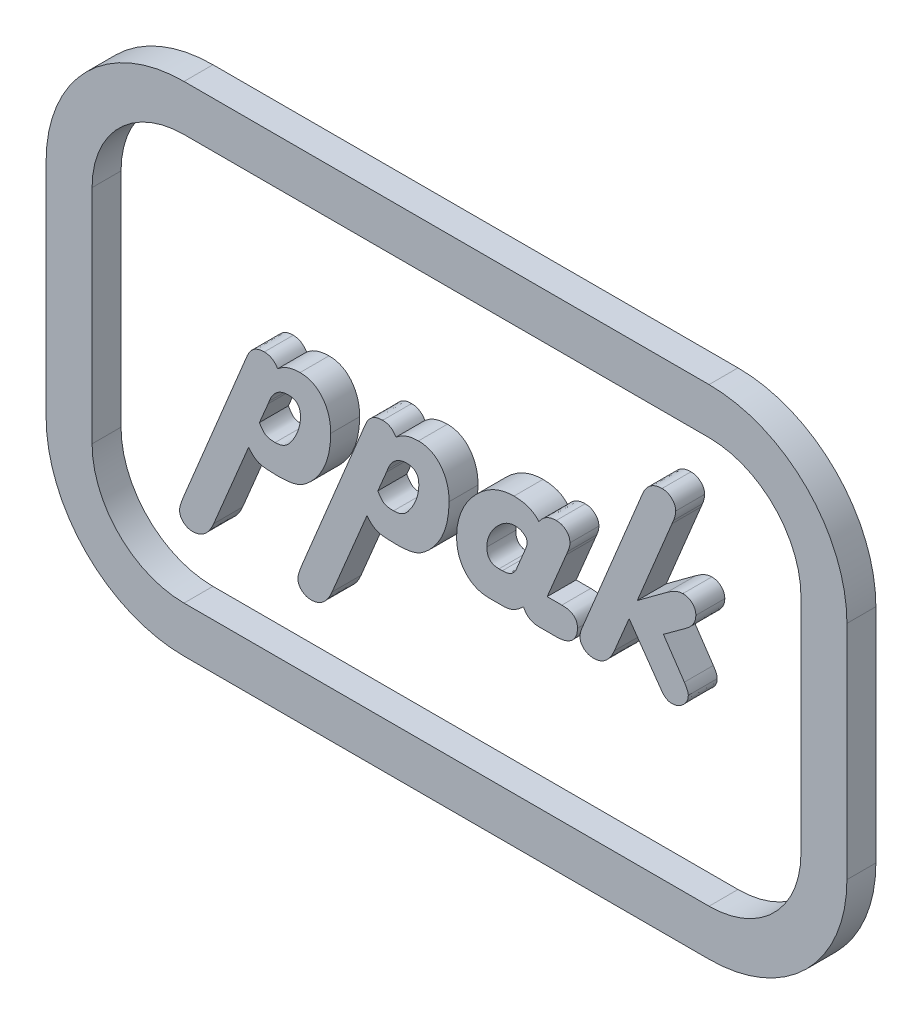
from build123d import *

# Parameters (mm, degrees)
BOSS_EXTRUDE1_DEPTH   = 1
BOSS_EXTRUDE1_2_DEPTH = 1
BOSS_EXTRUDE1_3_DEPTH = 1
BOSS_EXTRUDE1_4_DEPTH = 1
BOSS_EXTRUDE2_DEPTH   = 1


with BuildPart() as part:
    # Sketch1 → Boss-Extrude1 (new body)
    with BuildSketch(Plane.XY):
        with BuildLine():
            Line((-6.836579623, 0.35474101), (-8.042155394, -2.533476027))
            add(Edge.make_bspline(
                [(-8.042155394, -2.533476027), (-8.063354975, -2.580649846), (-8.103902871, -2.670878002), (-8.178148964, -2.792843804), (-8.257934921, -2.897269548), (-8.34564895, -2.983385989), (-8.4417999, -3.049720443), (-8.545520345, -3.096204742), (-8.656154842, -3.126513296), (-8.732860748, -3.129819027), (-8.772024829, -3.131506849)],
                knots=[0, 0, 0, 0, 1.233595779, 2.359467117, 3.400032463, 4.363738274, 5.281692613, 6.172289348, 7.066817518, 8, 8, 8, 8], degree=3))
            add(Edge.make_bspline(
                [(-8.772024829, -3.131506849), (-8.80205238, -3.129824185), (-8.8602156, -3.126564872), (-8.944636897, -3.104373054), (-9.020989743, -3.065272903), (-9.090162031, -3.014420965), (-9.14709228, -2.951845091), (-9.190403496, -2.882231014), (-9.216000728, -2.805206849), (-9.219019892, -2.752030985), (-9.220547945, -2.725117723)],
                knots=[0, 0, 0, 0, 1.073828919, 2.080001417, 3.094489531, 4.12502559, 5.134324473, 6.101378834, 7.039073625, 8, 8, 8, 8], degree=3))
            add(Edge.make_bspline(
                [(-9.220547945, -2.725117723), (-9.219044867, -2.698281433), (-9.215694263, -2.638459002), (-9.191039984, -2.540866381), (-9.154271042, -2.425805164), (-9.122292146, -2.343926031), (-9.105019264, -2.299700342)],
                knots=[0, 0, 0, 0, 0.726678964, 1.619884938, 2.714419364, 4, 4, 4, 4], degree=3))
            Line((-9.105019264, -2.299700342), (-6.882791096, 3.073062928))
            add(Edge.make_bspline(
                [(-6.882791096, 3.073062928), (-6.868207366, 3.105200238), (-6.839953517, 3.167461588), (-6.785387867, 3.251143937), (-6.722056789, 3.321183547), (-6.651896563, 3.379469475), (-6.573576701, 3.425173332), (-6.486396415, 3.456111761), (-6.3920803, 3.475533849), (-6.326538863, 3.47812352), (-6.29291524, 3.479452055)],
                knots=[0, 0, 0, 0, 1.105756702, 2.14224231, 3.118129428, 4.056898495, 4.992759649, 5.94572338, 6.946128963, 8, 8, 8, 8], degree=3))
            add(Edge.make_bspline(
                [(-6.29291524, 3.479452055), (-6.24667753, 3.47600602), (-6.15583615, 3.469235734), (-6.027468234, 3.416457942), (-5.916197854, 3.327050273), (-5.861052874, 3.247789412), (-5.832159675, 3.206260702)],
                knots=[0, 0, 0, 0, 0.987895729, 1.940879239, 2.92112416, 4, 4, 4, 4], degree=3))
            add(Edge.make_bspline(
                [(-5.832159675, 3.206260702), (-5.777893093, 3.2484315), (-5.669846102, 3.33239529), (-5.480917603, 3.417648736), (-5.275440092, 3.469638945), (-5.132518298, 3.476112763), (-5.058797089, 3.479452055)],
                knots=[0, 0, 0, 0, 0.981752114, 1.954708766, 2.94500805, 4, 4, 4, 4], degree=3))
            add(Edge.make_bspline(
                [(-5.058797089, 3.479452055), (-5.020237905, 3.478413189), (-4.944574103, 3.476374645), (-4.833591715, 3.460158319), (-4.729110949, 3.431107342), (-4.629270588, 3.393015672), (-4.535881008, 3.342519444), (-4.447569196, 3.281230994), (-4.367991798, 3.206140721), (-4.291270542, 3.124346089), (-4.224143098, 3.031440065), (-4.16380317, 2.9322573), (-4.113396357, 2.825619981), (-4.072700812, 2.711669361), (-4.039968926, 2.590849557), (-4.017189441, 2.462602607), (-4.003273974, 2.327648609), (-4.002013934, 2.235401396), (-4.001369863, 2.188249144)],
                knots=[0, 0, 0, 0, 0.987428927, 1.937609098, 2.863748343, 3.760187832, 4.668712679, 5.576570338, 6.504670283, 7.465560223, 8.444979229, 9.434043199, 10.435822681, 11.459934607, 12.529578907, 13.63804652, 14.7926852, 16, 16, 16, 16], degree=3))
            add(Edge.make_bspline(
                [(-4.001369863, 2.188249144), (-4.003363625, 2.098892348), (-4.007273926, 1.923639792), (-4.040781913, 1.667051267), (-4.094457216, 1.422910774), (-4.171399308, 1.191274087), (-4.268769027, 0.972385111), (-4.388744026, 0.766175395), (-4.52942136, 0.57197219), (-4.640159822, 0.455501609), (-4.695901113, 0.396875)],
                knots=[0, 0, 0, 0, 1.086059278, 2.130052466, 3.140384095, 4.121089527, 5.092593551, 6.047781849, 7.017331842, 8, 8, 8, 8], degree=3))
            add(Edge.make_bspline(
                [(-4.695901113, 0.396875), (-4.733781748, 0.361272887), (-4.806804727, 0.292642244), (-4.923345247, 0.20434602), (-5.041960188, 0.134591116), (-5.165768617, 0.080380468), (-5.303186718, 0.043441195), (-5.460372789, 0.019021243), (-5.64108051, 0.002532199), (-5.76959664, 0.000876208), (-5.837596318, 0)],
                knots=[0, 0, 0, 0, 0.998797502, 1.925394575, 2.803626065, 3.638381051, 4.515229771, 5.530295894, 6.693245065, 8, 8, 8, 8], degree=3))
            add(Edge.make_bspline(
                [(-5.837596318, 0), (-5.908753945, 0.0005699), (-6.039414228, 0.001616354), (-6.217238161, 0.013932514), (-6.360031288, 0.030600451), (-6.473829741, 0.059222429), (-6.569393471, 0.1050888), (-6.658271997, 0.170100399), (-6.749731089, 0.253252719), (-6.806512568, 0.319605655), (-6.836579623, 0.35474101)],
                knots=[0, 0, 0, 0, 1.53519449, 2.818938113, 3.84486776, 4.63459067, 5.338636183, 6.117144677, 7.002986248, 8, 8, 8, 8], degree=3))
        make_face()
        with BuildLine():
            add(Edge.make_bspline(
                [(-6.461451199, 1.283047945), (-6.443645173, 1.251288263), (-6.410620271, 1.192383462), (-6.353683515, 1.117665072), (-6.302012797, 1.057748815), (-6.246881081, 1.01381881), (-6.182523716, 0.988295382), (-6.107771482, 0.968916973), (-6.01814427, 0.959309901), (-5.953590988, 0.95770544), (-5.919145976, 0.956849315)],
                knots=[0, 0, 0, 0, 1.281705762, 2.377184463, 3.304212624, 4.067557999, 4.832905158, 5.723741181, 6.78541012, 8, 8, 8, 8], degree=3))
            add(Edge.make_bspline(
                [(-5.919145976, 0.956849315), (-5.867515726, 0.959320235), (-5.768429414, 0.964062305), (-5.629846186, 1.011843893), (-5.506674027, 1.085172284), (-5.44487923, 1.156942733), (-5.413538099, 1.193343322)],
                knots=[0, 0, 0, 0, 1.066885074, 2.04751495, 3.009737206, 4, 4, 4, 4], degree=3))
            add(Edge.make_bspline(
                [(-5.413538099, 1.193343322), (-5.383908381, 1.232768254), (-5.325789519, 1.310100485), (-5.250936173, 1.43160239), (-5.188457816, 1.554176252), (-5.136643418, 1.676791926), (-5.094600918, 1.800034694), (-5.067059083, 1.925009163), (-5.047978429, 2.050388542), (-5.046127037, 2.134265632), (-5.045205479, 2.176016695)],
                knots=[0, 0, 0, 0, 1.106882035, 2.17115544, 3.199327812, 4.193108843, 5.158152015, 6.118088392, 7.063250621, 8, 8, 8, 8], degree=3))
            add(Edge.make_bspline(
                [(-5.045205479, 2.176016695), (-5.046493845, 2.210078562), (-5.048921871, 2.274270799), (-5.067113657, 2.363990339), (-5.100382564, 2.440167957), (-5.147318026, 2.50266881), (-5.20778279, 2.552030311), (-5.282104725, 2.585973252), (-5.3689745, 2.606248309), (-5.431088782, 2.608435991), (-5.463827055, 2.609589041)],
                knots=[0, 0, 0, 0, 1.183423394, 2.230253451, 3.160617766, 4.048586677, 4.921493439, 5.844099008, 6.863699742, 8, 8, 8, 8], degree=3))
            add(Edge.make_bspline(
                [(-5.463827055, 2.609589041), (-5.501126902, 2.608159726), (-5.573417696, 2.605389572), (-5.677769508, 2.579827933), (-5.773549635, 2.538673831), (-5.862587522, 2.482251312), (-5.941338814, 2.407808073), (-6.011582714, 2.317168527), (-6.073991109, 2.211093551), (-6.107170428, 2.132508038), (-6.124379281, 2.091748716)],
                knots=[0, 0, 0, 0, 0.994323491, 1.927097285, 2.848115774, 3.767306292, 4.725678418, 5.724844064, 6.819962974, 8, 8, 8, 8], degree=3))
            add(Edge.make_bspline(
                [(-6.124379281, 2.091748716), (-6.131215988, 2.074095158), (-6.143644428, 2.042002786), (-6.155667345, 2.009756397), (-6.161076627, 1.995248288)],
                knots=[0, 0, 0, 0, 1.10017156, 2, 2, 2, 2], degree=3))
            Line((-6.161076627, 1.995248288), (-6.461451199, 1.283047945))
        make_face(mode=Mode.SUBTRACT)
    extrude(amount=BOSS_EXTRUDE1_DEPTH)


with BuildPart() as body_2:
    # Sketch1 → Boss-Extrude1 2 (new body)
    with BuildSketch(Plane.XY):
        with BuildLine():
            Line((-2.748223459, 0.35474101), (-3.953799229, -2.533476027))
            add(Edge.make_bspline(
                [(-3.953799229, -2.533476027), (-3.97499881, -2.580649846), (-4.015546707, -2.670878002), (-4.0897928, -2.792843804), (-4.169578757, -2.897269548), (-4.257292786, -2.983385989), (-4.353443735, -3.049720443), (-4.457164181, -3.096204742), (-4.567798678, -3.126513296), (-4.644504584, -3.129819027), (-4.683668664, -3.131506849)],
                knots=[0, 0, 0, 0, 1.233595779, 2.359467117, 3.400032463, 4.363738274, 5.281692613, 6.172289348, 7.066817518, 8, 8, 8, 8], degree=3))
            add(Edge.make_bspline(
                [(-4.683668664, -3.131506849), (-4.713696215, -3.129824185), (-4.771859436, -3.126564872), (-4.856280732, -3.104373054), (-4.932633579, -3.065272903), (-5.001805867, -3.014420965), (-5.058736116, -2.951845091), (-5.102047331, -2.882231014), (-5.127644563, -2.805206849), (-5.130663727, -2.752030985), (-5.132191781, -2.725117723)],
                knots=[0, 0, 0, 0, 1.073828919, 2.080001417, 3.094489531, 4.12502559, 5.134324473, 6.101378834, 7.039073625, 8, 8, 8, 8], degree=3))
            add(Edge.make_bspline(
                [(-5.132191781, -2.725117723), (-5.130688703, -2.698281433), (-5.127338098, -2.638459002), (-5.10268382, -2.540866381), (-5.065914877, -2.425805164), (-5.033935982, -2.343926031), (-5.016663099, -2.299700342)],
                knots=[0, 0, 0, 0, 0.726678964, 1.619884938, 2.714419364, 4, 4, 4, 4], degree=3))
            Line((-5.016663099, -2.299700342), (-2.794434932, 3.073062928))
            add(Edge.make_bspline(
                [(-2.794434932, 3.073062928), (-2.779851202, 3.105200238), (-2.751597352, 3.167461588), (-2.697031703, 3.251143937), (-2.633700625, 3.321183547), (-2.563540398, 3.379469475), (-2.485220537, 3.425173332), (-2.39804025, 3.456111761), (-2.303724135, 3.475533849), (-2.238182698, 3.47812352), (-2.204559075, 3.479452055)],
                knots=[0, 0, 0, 0, 1.105756702, 2.14224231, 3.118129428, 4.056898495, 4.992759649, 5.94572338, 6.946128963, 8, 8, 8, 8], degree=3))
            add(Edge.make_bspline(
                [(-2.204559075, 3.479452055), (-2.158321365, 3.47600602), (-2.067479985, 3.469235734), (-1.939112069, 3.416457942), (-1.827841689, 3.327050273), (-1.772696709, 3.247789412), (-1.74380351, 3.206260702)],
                knots=[0, 0, 0, 0, 0.987895729, 1.940879239, 2.92112416, 4, 4, 4, 4], degree=3))
            add(Edge.make_bspline(
                [(-1.74380351, 3.206260702), (-1.689536929, 3.2484315), (-1.581489938, 3.33239529), (-1.392561438, 3.417648736), (-1.187083928, 3.469638945), (-1.044162134, 3.476112763), (-0.970440925, 3.479452055)],
                knots=[0, 0, 0, 0, 0.981752114, 1.954708766, 2.94500805, 4, 4, 4, 4], degree=3))
            add(Edge.make_bspline(
                [(-0.970440925, 3.479452055), (-0.93188174, 3.478413189), (-0.856217938, 3.476374645), (-0.745235551, 3.460158319), (-0.640754785, 3.431107342), (-0.540914423, 3.393015672), (-0.447524844, 3.342519444), (-0.359213032, 3.281230994), (-0.279635634, 3.206140721), (-0.202914378, 3.124346089), (-0.135786933, 3.031440065), (-0.075447005, 2.9322573), (-0.025040193, 2.825619981), (0.015655353, 2.711669361), (0.048387239, 2.590849557), (0.071166724, 2.462602607), (0.08508219, 2.327648609), (0.086342231, 2.235401396), (0.086986301, 2.188249144)],
                knots=[0, 0, 0, 0, 0.987428927, 1.937609098, 2.863748343, 3.760187832, 4.668712679, 5.576570338, 6.504670283, 7.465560223, 8.444979229, 9.434043199, 10.435822681, 11.459934607, 12.529578907, 13.63804652, 14.7926852, 16, 16, 16, 16], degree=3))
            add(Edge.make_bspline(
                [(0.086986301, 2.188249144), (0.084992539, 2.098892348), (0.081082238, 1.923639792), (0.047574251, 1.667051267), (-0.006101051, 1.422910774), (-0.083043144, 1.191274087), (-0.180412863, 0.972385111), (-0.300387861, 0.766175395), (-0.441065195, 0.57197219), (-0.551803657, 0.455501609), (-0.607544949, 0.396875)],
                knots=[0, 0, 0, 0, 1.086059278, 2.130052466, 3.140384095, 4.121089527, 5.092593551, 6.047781849, 7.017331842, 8, 8, 8, 8], degree=3))
            add(Edge.make_bspline(
                [(-0.607544949, 0.396875), (-0.645425584, 0.361272887), (-0.718448563, 0.292642244), (-0.834989082, 0.20434602), (-0.953604024, 0.134591116), (-1.077412452, 0.080380468), (-1.214830554, 0.043441195), (-1.372016625, 0.019021243), (-1.552724346, 0.002532199), (-1.681240475, 0.000876208), (-1.749240154, 0)],
                knots=[0, 0, 0, 0, 0.998797502, 1.925394575, 2.803626065, 3.638381051, 4.515229771, 5.530295894, 6.693245065, 8, 8, 8, 8], degree=3))
            add(Edge.make_bspline(
                [(-1.749240154, 0), (-1.820397781, 0.0005699), (-1.951058063, 0.001616354), (-2.128881997, 0.013932514), (-2.271675124, 0.030600451), (-2.385473577, 0.059222429), (-2.481037306, 0.1050888), (-2.569915833, 0.170100399), (-2.661374925, 0.253252719), (-2.718156404, 0.319605655), (-2.748223459, 0.35474101)],
                knots=[0, 0, 0, 0, 1.53519449, 2.818938113, 3.84486776, 4.63459067, 5.338636183, 6.117144677, 7.002986248, 8, 8, 8, 8], degree=3))
        make_face()
        with BuildLine():
            add(Edge.make_bspline(
                [(-2.373095034, 1.283047945), (-2.355289009, 1.251288263), (-2.322264107, 1.192383462), (-2.265327351, 1.117665072), (-2.213656632, 1.057748815), (-2.158524917, 1.01381881), (-2.094167552, 0.988295382), (-2.019415318, 0.968916973), (-1.929788105, 0.959309901), (-1.865234824, 0.95770544), (-1.830789812, 0.956849315)],
                knots=[0, 0, 0, 0, 1.281705762, 2.377184463, 3.304212624, 4.067557999, 4.832905158, 5.723741181, 6.78541012, 8, 8, 8, 8], degree=3))
            add(Edge.make_bspline(
                [(-1.830789812, 0.956849315), (-1.779159562, 0.959320235), (-1.680073249, 0.964062305), (-1.541490021, 1.011843893), (-1.418317863, 1.085172284), (-1.356523065, 1.156942733), (-1.325181935, 1.193343322)],
                knots=[0, 0, 0, 0, 1.066885074, 2.04751495, 3.009737206, 4, 4, 4, 4], degree=3))
            add(Edge.make_bspline(
                [(-1.325181935, 1.193343322), (-1.295552217, 1.232768254), (-1.237433355, 1.310100485), (-1.162580009, 1.43160239), (-1.100101651, 1.554176252), (-1.048287253, 1.676791926), (-1.006244753, 1.800034694), (-0.978702919, 1.925009163), (-0.959622265, 2.050388542), (-0.957770873, 2.134265632), (-0.956849315, 2.176016695)],
                knots=[0, 0, 0, 0, 1.106882035, 2.17115544, 3.199327812, 4.193108843, 5.158152015, 6.118088392, 7.063250621, 8, 8, 8, 8], degree=3))
            add(Edge.make_bspline(
                [(-0.956849315, 2.176016695), (-0.958137681, 2.210078562), (-0.960565707, 2.274270799), (-0.978757492, 2.363990339), (-1.0120264, 2.440167957), (-1.058961862, 2.50266881), (-1.119426625, 2.552030311), (-1.193748561, 2.585973252), (-1.280618335, 2.606248309), (-1.342732618, 2.608435991), (-1.37547089, 2.609589041)],
                knots=[0, 0, 0, 0, 1.183423394, 2.230253451, 3.160617766, 4.048586677, 4.921493439, 5.844099008, 6.863699742, 8, 8, 8, 8], degree=3))
            add(Edge.make_bspline(
                [(-1.37547089, 2.609589041), (-1.412770738, 2.608159726), (-1.485061532, 2.605389572), (-1.589413343, 2.579827933), (-1.68519347, 2.538673831), (-1.774231357, 2.482251312), (-1.852982649, 2.407808073), (-1.923226549, 2.317168527), (-1.985634945, 2.211093551), (-2.018814263, 2.132508038), (-2.036023116, 2.091748716)],
                knots=[0, 0, 0, 0, 0.994323491, 1.927097285, 2.848115774, 3.767306292, 4.725678418, 5.724844064, 6.819962974, 8, 8, 8, 8], degree=3))
            add(Edge.make_bspline(
                [(-2.036023116, 2.091748716), (-2.042859824, 2.074095158), (-2.055288263, 2.042002786), (-2.067311181, 2.009756397), (-2.072720462, 1.995248288)],
                knots=[0, 0, 0, 0, 1.10017156, 2, 2, 2, 2], degree=3))
            Line((-2.072720462, 1.995248288), (-2.373095034, 1.283047945))
        make_face(mode=Mode.SUBTRACT)
    extrude(amount=BOSS_EXTRUDE1_2_DEPTH)


with BuildPart() as body_3:
    # Sketch1 → Boss-Extrude1 3 (new body)
    with BuildSketch(Plane.XY):
        with BuildLine():
            Line((3.476733733, 1.043835616), (3.98234161, 1.043835616))
            add(Edge.make_bspline(
                [(3.98234161, 1.043835616), (4.02452349, 1.042506373), (4.103935384, 1.04000393), (4.215864046, 1.022335916), (4.310084339, 0.987880476), (4.39007905, 0.943620611), (4.449857437, 0.88135944), (4.493210246, 0.8069304), (4.519708089, 0.718916333), (4.522052642, 0.655762814), (4.523287671, 0.622495719)],
                knots=[0, 0, 0, 0, 1.294214641, 2.436497235, 3.45633191, 4.35958604, 5.214514041, 6.067746316, 6.982155433, 8, 8, 8, 8], degree=3))
            add(Edge.make_bspline(
                [(4.523287671, 0.622495719), (4.521148494, 0.576037578), (4.517046327, 0.486947666), (4.4798077, 0.360748831), (4.41498892, 0.25235422), (4.328365393, 0.159655609), (4.219008486, 0.087712502), (4.090939917, 0.034996233), (3.94372034, 0.006320504), (3.83974765, 0.002173262), (3.785263271, 0)],
                knots=[0, 0, 0, 0, 1.02006706, 1.956119682, 2.85821293, 3.77438774, 4.72208319, 5.713685443, 6.801912016, 8, 8, 8, 8], degree=3))
            Line((3.785263271, 0), (3.198105736, 0))
            add(Edge.make_bspline(
                [(3.198105736, 0), (3.166331732, 0.001056591), (3.105575772, 0.003076928), (3.018122978, 0.018078334), (2.938386755, 0.044012893), (2.866110894, 0.080384811), (2.802487433, 0.127984205), (2.745863751, 0.184113634), (2.697554475, 0.251670225), (2.673583397, 0.302656571), (2.661237158, 0.328916952)],
                knots=[0, 0, 0, 0, 1.135602606, 2.17141737, 3.159933094, 4.123316935, 5.049777826, 5.988893951, 6.964185235, 8, 8, 8, 8], degree=3))
            add(Edge.make_bspline(
                [(2.661237158, 0.328916952), (2.606185845, 0.278774613), (2.502457221, 0.184295561), (2.331358648, 0.082236738), (2.164050292, 0.012255813), (2.05022531, 0.003991588), (1.995248288, 0)],
                knots=[0, 0, 0, 0, 1.172355213, 2.208971714, 3.134940325, 4, 4, 4, 4], degree=3))
            Line((1.995248288, 0), (1.473330479, 0))
            add(Edge.make_bspline(
                [(1.473330479, 0), (1.432039433, 0.00096817), (1.351386036, 0.002859288), (1.233537506, 0.019891535), (1.121447253, 0.046124124), (1.016402742, 0.086803587), (0.916497804, 0.13518507), (0.822874128, 0.195828693), (0.73648765, 0.268137451), (0.655721614, 0.349589556), (0.584457231, 0.441069616), (0.519771972, 0.538506666), (0.466950168, 0.644236936), (0.423207876, 0.75614656), (0.389634794, 0.8745476), (0.364472302, 0.99942422), (0.351691056, 1.13146277), (0.349212714, 1.221863277), (0.347945205, 1.268097175)],
                knots=[0, 0, 0, 0, 1.038881097, 2.029236264, 2.991883691, 3.930308829, 4.858629969, 5.782385855, 6.730121337, 7.689859128, 8.664191716, 9.644845373, 10.629272188, 11.633194497, 12.665607055, 13.723595041, 14.835769002, 16, 16, 16, 16], degree=3))
            add(Edge.make_bspline(
                [(0.347945205, 1.268097175), (0.349707489, 1.338875297), (0.353190259, 1.478752839), (0.383036056, 1.685781851), (0.430122427, 1.887049331), (0.497276053, 2.082766533), (0.58380406, 2.271963482), (0.686713442, 2.456807824), (0.812386049, 2.63378654), (0.952747033, 2.80416919), (1.105517153, 2.960979196), (1.264781916, 3.099956106), (1.430823783, 3.21576747), (1.600002435, 3.313624146), (1.776135106, 3.387271379), (1.956416913, 3.440977111), (2.14226877, 3.472871929), (2.267867419, 3.477251837), (2.330961045, 3.479452055)],
                knots=[0, 0, 0, 0, 1.038393463, 2.052158511, 3.063456151, 4.068635755, 5.08344709, 6.113632118, 7.168837633, 8.264602753, 9.350863708, 10.378663772, 11.361961956, 12.31789787, 13.241700555, 14.156967694, 15.07416527, 16, 16, 16, 16], degree=3))
            add(Edge.make_bspline(
                [(2.330961045, 3.479452055), (2.378101024, 3.478286595), (2.469457213, 3.47602796), (2.602204123, 3.462118841), (2.724455952, 3.433596581), (2.838578369, 3.400104216), (2.941044884, 3.351249541), (3.0345284, 3.294105411), (3.118787207, 3.226336786), (3.165353533, 3.17214292), (3.18859161, 3.145098459)],
                knots=[0, 0, 0, 0, 1.187749171, 2.30183041, 3.353985773, 4.346587157, 5.291117026, 6.203238886, 7.103359092, 8, 8, 8, 8], degree=3))
            add(Edge.make_bspline(
                [(3.18859161, 3.145098459), (3.207957149, 3.171828114), (3.245576603, 3.223753082), (3.309979116, 3.292164519), (3.378859081, 3.350018693), (3.451772274, 3.398395088), (3.530971633, 3.432953477), (3.612298443, 3.461570417), (3.699584108, 3.476036297), (3.758943906, 3.478295279), (3.789340753, 3.479452055)],
                knots=[0, 0, 0, 0, 1.102961423, 2.142610407, 3.131917189, 4.106850711, 5.056016811, 6.014208465, 6.983119812, 8, 8, 8, 8], degree=3))
            add(Edge.make_bspline(
                [(3.789340753, 3.479452055), (3.8216237, 3.477797113), (3.884785592, 3.474559205), (3.975373463, 3.45192323), (4.056415958, 3.410611416), (4.127599514, 3.356704688), (4.188294698, 3.292277197), (4.230701554, 3.217028567), (4.258476681, 3.134780762), (4.261022781, 3.076918503), (4.262328767, 3.04723887)],
                knots=[0, 0, 0, 0, 1.085152088, 2.123110344, 3.11068521, 4.121931818, 5.11360817, 6.061884541, 7.005870879, 8, 8, 8, 8], degree=3))
            add(Edge.make_bspline(
                [(4.262328767, 3.04723887), (4.261533328, 3.025432396), (4.259845836, 2.97917082), (4.245126076, 2.907219732), (4.222034053, 2.829397744), (4.200318831, 2.777035076), (4.188934075, 2.74958262)],
                knots=[0, 0, 0, 0, 0.847236183, 1.797378234, 2.845219729, 4, 4, 4, 4], degree=3))
            Line((4.188934075, 2.74958262), (4.13864512, 2.628617295))
            Line((4.13864512, 2.628617295), (3.476733733, 1.043835616))
        make_face()
        with BuildLine():
            Line((1.811761558, 1.043835616), (1.92729024, 1.043835616))
            add(Edge.make_bspline(
                [(1.92729024, 1.043835616), (1.95633743, 1.044472463), (2.012514616, 1.045704124), (2.093084288, 1.059234861), (2.165713064, 1.082461862), (2.231147384, 1.113936195), (2.288426565, 1.155023391), (2.338478324, 1.204703672), (2.379820578, 1.264388078), (2.400487179, 1.308971724), (2.411151541, 1.33197774)],
                knots=[0, 0, 0, 0, 1.157664044, 2.238919033, 3.244614913, 4.190073881, 5.122668863, 6.042574887, 6.989931157, 8, 8, 8, 8], degree=3))
            Line((2.411151541, 1.33197774), (2.72104024, 2.076797945))
            add(Edge.make_bspline(
                [(2.72104024, 2.076797945), (2.739555334, 2.121007071), (2.772483951, 2.199631862), (2.780188991, 2.284359787), (2.783561644, 2.321446918)],
                knots=[0, 0, 0, 0, 1.124559448, 2, 2, 2, 2], degree=3))
            add(Edge.make_bspline(
                [(2.783561644, 2.321446918), (2.781714326, 2.34017492), (2.777987692, 2.377955337), (2.755818532, 2.433399187), (2.713357203, 2.480667534), (2.661130729, 2.525169888), (2.597874374, 2.562857909), (2.526557199, 2.589837367), (2.449089621, 2.606795264), (2.395385688, 2.608637761), (2.36765839, 2.609589041)],
                knots=[0, 0, 0, 0, 0.81058345, 1.635208074, 2.524363624, 3.523748651, 4.593951107, 5.683817953, 6.804157088, 8, 8, 8, 8], degree=3))
            add(Edge.make_bspline(
                [(2.36765839, 2.609589041), (2.339473265, 2.608637096), (2.282549852, 2.606714522), (2.198134465, 2.587864309), (2.114628297, 2.559291529), (2.031763706, 2.518827139), (1.949492875, 2.467179201), (1.867219767, 2.404311584), (1.787446216, 2.328516929), (1.682766067, 2.217333621), (1.569704266, 2.067474441), (1.468308311, 1.878036794), (1.404012666, 1.684006721), (1.395830251, 1.552168192), (1.391780822, 1.486922089)],
                knots=[0, 0, 0, 0, 0.627706518, 1.267732443, 1.919531944, 2.592823818, 3.31892668, 4.082778462, 4.897707917, 5.769757387, 7.487317347, 9.064628885, 10.547302323, 12, 12, 12, 12], degree=3))
            add(Edge.make_bspline(
                [(1.391780822, 1.486922089), (1.393084859, 1.45240254), (1.395560805, 1.386861086), (1.413855302, 1.295050921), (1.446191925, 1.216535168), (1.494374844, 1.152977017), (1.555442335, 1.103269153), (1.629647695, 1.067069572), (1.71696756, 1.047301982), (1.779043496, 1.045032029), (1.811761558, 1.043835616)],
                knots=[0, 0, 0, 0, 1.183693291, 2.247450585, 3.194323595, 4.070859252, 4.954393584, 5.871857821, 6.878330445, 8, 8, 8, 8], degree=3))
        make_face(mode=Mode.SUBTRACT)
    extrude(amount=BOSS_EXTRUDE1_3_DEPTH)


with BuildPart() as body_4:
    # Sketch1 → Boss-Extrude1 4 (new body)
    with BuildSketch(Plane.XY):
        with BuildLine():
            Line((7.491695205, 1.924571918), (8.214768836, 0.854912243))
            add(Edge.make_bspline(
                [(8.214768836, 0.854912243), (8.235462933, 0.823624583), (8.273730963, 0.765766682), (8.316180386, 0.679083107), (8.345055967, 0.601658518), (8.348922082, 0.551558112), (8.350684932, 0.528713613)],
                knots=[0, 0, 0, 0, 1.255887376, 2.322417502, 3.235065423, 4, 4, 4, 4], degree=3))
            add(Edge.make_bspline(
                [(8.350684932, 0.528713613), (8.348745233, 0.495330382), (8.344867094, 0.428585592), (8.308180655, 0.332575027), (8.250656468, 0.242740886), (8.174520839, 0.160619324), (8.084623191, 0.09059609), (7.986554293, 0.037951494), (7.88137242, 0.006616958), (7.809490157, 0.002226319), (7.773041524, 0)],
                knots=[0, 0, 0, 0, 0.928583691, 1.856564545, 2.828310101, 3.893239512, 4.965649554, 5.995080196, 6.983384995, 8, 8, 8, 8], degree=3))
            add(Edge.make_bspline(
                [(7.773041524, 0), (7.741322045, 0.002144729), (7.677758863, 0.006442587), (7.588507191, 0.048859572), (7.50415544, 0.110853521), (7.459573343, 0.168118751), (7.435969606, 0.1984375)],
                knots=[0, 0, 0, 0, 0.931433446, 1.866514693, 2.870438376, 4, 4, 4, 4], degree=3))
            Line((7.435969606, 0.1984375), (7.380244007, 0.277268836))
            Line((7.380244007, 0.277268836), (6.30786601, 1.802247432))
            Line((6.30786601, 1.802247432), (5.79682149, 0.584439212))
            add(Edge.make_bspline(
                [(5.79682149, 0.584439212), (5.776048553, 0.538190034), (5.736351619, 0.449808184), (5.663682977, 0.330042053), (5.583806012, 0.228957236), (5.496570784, 0.145574583), (5.402787152, 0.078410649), (5.299085561, 0.034225347), (5.189484683, 0.005268705), (5.113806975, 0.001782679), (5.075107021, 0)],
                knots=[0, 0, 0, 0, 1.228664961, 2.347969998, 3.387825304, 4.343721817, 5.267244801, 6.167534526, 7.062916538, 8, 8, 8, 8], degree=3))
            add(Edge.make_bspline(
                [(5.075107021, 0), (5.04374225, 0.001748198), (4.982502908, 0.005161533), (4.893854612, 0.026579568), (4.814240883, 0.065881156), (4.743124606, 0.117141309), (4.684889648, 0.180642981), (4.642170255, 0.252358591), (4.614251791, 0.330551542), (4.611615664, 0.385313233), (4.610273973, 0.413184932)],
                knots=[0, 0, 0, 0, 1.089189128, 2.126628872, 3.1394618, 4.152294729, 5.154079579, 6.106120088, 7.03608434, 8, 8, 8, 8], degree=3))
            add(Edge.make_bspline(
                [(4.610273973, 0.413184932), (4.61092893, 0.435922998), (4.61231729, 0.48412248), (4.629265624, 0.55740412), (4.650263486, 0.637100054), (4.67211177, 0.689774335), (4.683668664, 0.717636986)],
                knots=[0, 0, 0, 0, 0.864121176, 1.831738591, 2.853073858, 4, 4, 4, 4], degree=3))
            Line((4.683668664, 0.717636986), (4.735316781, 0.839961473))
            Line((4.735316781, 0.839961473), (6.714255137, 5.632363014))
            Line((6.714255137, 5.632363014), (6.764544092, 5.7546875))
            add(Edge.make_bspline(
                [(6.764544092, 5.7546875), (6.78260389, 5.795047809), (6.817312142, 5.87261434), (6.883055711, 5.97696001), (6.957221788, 6.06511828), (7.038443876, 6.138345552), (7.129408367, 6.193177965), (7.226294082, 6.235359704), (7.332996858, 6.258179909), (7.406423221, 6.26137378), (7.444124572, 6.263013699)],
                knots=[0, 0, 0, 0, 1.170115595, 2.248788727, 3.253647746, 4.214329002, 5.130195442, 6.055136286, 7.001394233, 8, 8, 8, 8], degree=3))
            add(Edge.make_bspline(
                [(7.444124572, 6.263013699), (7.475564288, 6.261548689), (7.537183008, 6.258677415), (7.625189231, 6.233092378), (7.706801702, 6.192839804), (7.77843453, 6.136034187), (7.83940915, 6.069362306), (7.884781478, 5.993906723), (7.911461983, 5.910942956), (7.914312903, 5.853187537), (7.915753425, 5.824004709)],
                knots=[0, 0, 0, 0, 1.052880146, 2.063540459, 3.049313818, 4.0892747, 5.111869003, 6.066075102, 7.022820756, 8, 8, 8, 8], degree=3))
            add(Edge.make_bspline(
                [(7.915753425, 5.824004709), (7.915082734, 5.800369044), (7.913664541, 5.750390824), (7.896979506, 5.673729249), (7.874080735, 5.590855578), (7.852406783, 5.5352348), (7.840999572, 5.505961045)],
                knots=[0, 0, 0, 0, 0.861683695, 1.822052244, 2.853724972, 4, 4, 4, 4], degree=3))
            Line((7.840999572, 5.505961045), (7.787992295, 5.380918236))
            Line((7.787992295, 5.380918236), (6.587853168, 2.483187072))
            Line((6.587853168, 2.483187072), (7.615378853, 3.242958048))
            add(Edge.make_bspline(
                [(7.615378853, 3.242958048), (7.666335874, 3.278495989), (7.761377498, 3.344778977), (7.90450293, 3.421401644), (8.037880446, 3.468699471), (8.124311798, 3.476040423), (8.16447988, 3.479452055)],
                knots=[0, 0, 0, 0, 1.227777704, 2.28996874, 3.205280566, 4, 4, 4, 4], degree=3))
            add(Edge.make_bspline(
                [(8.16447988, 3.479452055), (8.19546311, 3.477960081), (8.255187606, 3.475084094), (8.34044047, 3.450664683), (8.418211867, 3.412558041), (8.485447492, 3.357887145), (8.541082304, 3.292870494), (8.58341228, 3.220067252), (8.606968757, 3.138355671), (8.610053809, 3.081815918), (8.611643836, 3.052675514)],
                knots=[0, 0, 0, 0, 1.077191635, 2.076437133, 3.064405517, 4.074802271, 5.070928044, 6.031939203, 6.985667898, 8, 8, 8, 8], degree=3))
            add(Edge.make_bspline(
                [(8.611643836, 3.052675514), (8.61047403, 3.027248213), (8.608155958, 2.976861777), (8.593236572, 2.901820007), (8.564829544, 2.829820438), (8.528595006, 2.758420727), (8.479695409, 2.690540978), (8.422346269, 2.622830264), (8.352634828, 2.558281923), (8.301140594, 2.517711282), (8.274571918, 2.496778682)],
                knots=[0, 0, 0, 0, 0.904161073, 1.791674836, 2.703974593, 3.647578222, 4.630492943, 5.669839074, 6.797743255, 8, 8, 8, 8], degree=3))
            Line((8.274571918, 2.496778682), (8.169916524, 2.420665668))
            Line((8.169916524, 2.420665668), (7.491695205, 1.924571918))
        make_face()
    extrude(amount=BOSS_EXTRUDE1_4_DEPTH)


with BuildPart() as body_5:
    # Sketch2 → Boss-Extrude2 (new body)
    with BuildSketch(Plane.XY):
        with BuildLine():
            Line((-13.829860599, -2.245323616), (-13.829860599, 5.420323616))
            ThreePointArc((-13.829860599, 5.420323616), (-12.434956644, 8.787919662), (-9.067360599, 10.182823616))
            Line((-9.067360599, 10.182823616), (9.067360599, 10.182823616))
            ThreePointArc((9.067360599, 10.182823616), (12.434956644, 8.787919662), (13.829860599, 5.420323616))
            Line((13.829860599, 5.420323616), (13.829860599, -2.245323616))
            ThreePointArc((13.829860599, -2.245323616), (12.434956644, -5.612919662), (9.067360599, -7.007823616))
            Line((9.067360599, -7.007823616), (-9.067360599, -7.007823616))
            ThreePointArc((-9.067360599, -7.007823616), (-12.434956644, -5.612919662), (-13.829860599, -2.245323616))
        make_face()
        with BuildLine():
            Line((-9.067360599, -5.420323616), (9.067360599, -5.420323616))
            ThreePointArc((9.067360599, -5.420323616), (11.312424629, -4.490387647), (12.242360599, -2.245323616))
            Line((12.242360599, -2.245323616), (12.242360599, 5.420323616))
            ThreePointArc((12.242360599, 5.420323616), (11.312424629, 7.665387647), (9.067360599, 8.595323616))
            Line((9.067360599, 8.595323616), (-9.067360599, 8.595323616))
            ThreePointArc((-9.067360599, 8.595323616), (-11.312424629, 7.665387647), (-12.242360599, 5.420323616))
            Line((-12.242360599, 5.420323616), (-12.242360599, -2.245323616))
            ThreePointArc((-12.242360599, -2.245323616), (-11.312424629, -4.490387647), (-9.067360599, -5.420323616))
        make_face(mode=Mode.SUBTRACT)
    extrude(amount=BOSS_EXTRUDE2_DEPTH)


solid = Compound([part.part, body_2.part, body_3.part, body_4.part, body_5.part])
